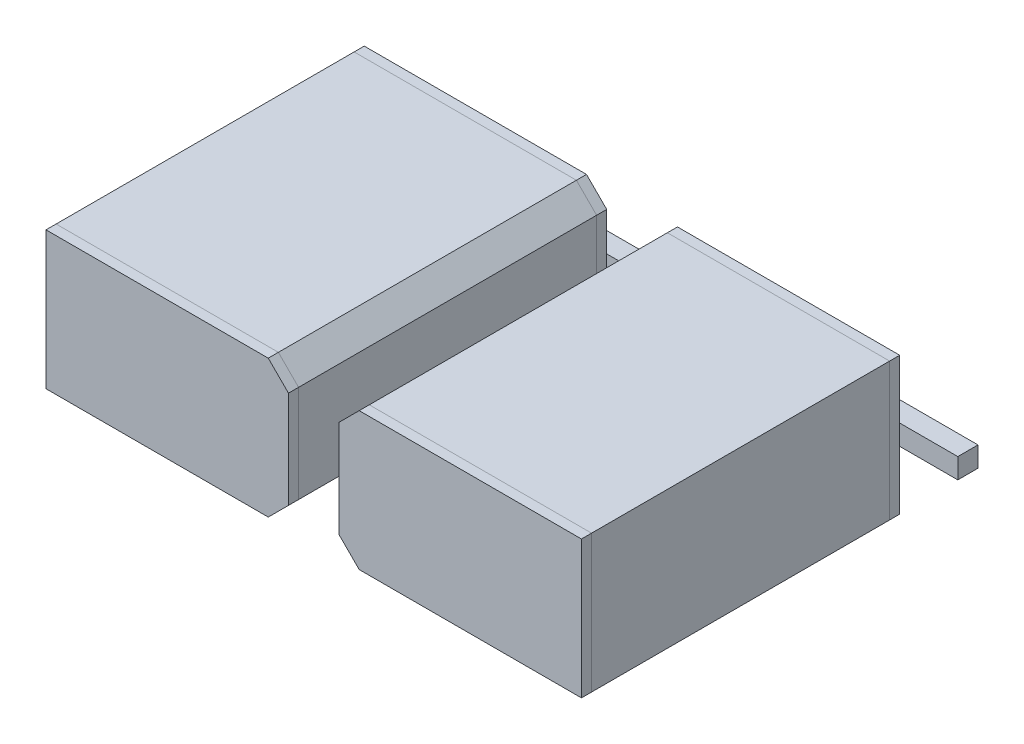
from build123d import *

# Parameters (mm, degrees)
CROQUIS1_W                = 152.375
CROQUIS1_H                = 86.5
SALIENTE_EXTRUIR1_DEPTH   = 6.35
SALIENTE_EXTRUIR1_2_DEPTH = 6.35
CHAFL_N1_SIZE             = 12.7
CHAFL_N2_SIZE             = 12.7
SALIENTE_EXTRUIR2_DEPTH   = 187.3
SALIENTE_EXTRUIR2_2_DEPTH = 187.3
SALIENTE_EXTRUIR3_DEPTH   = 6.35
SALIENTE_EXTRUIR3_2_DEPTH = 6.35
CROQUIS4_W                = 409.5
CROQUIS4_H                = 12.7
SALIENTE_EXTRUIR4_DEPTH   = 12.7


with BuildPart() as part:
    # Croquis1 → Saliente-Extruir1 (new body)
    with BuildSketch(Plane.XY):
        with Locations((107.9375, 75)):
            Rectangle(CROQUIS1_W, CROQUIS1_H)
    extrude(amount=SALIENTE_EXTRUIR1_DEPTH)

    # Chaflán1
    chafl_n1_edges = [part.edges().sort_by_distance(p)[0] for p in [
        (184.125, 118.25, 3.175),
        (184.125, 31.75, 3.175),
    ]]
    chamfer(chafl_n1_edges, length=CHAFL_N1_SIZE)


with BuildPart() as body_2:
    # Croquis1 → Saliente-Extruir1 2 (new body)
    with BuildSketch(Plane.XY):
        with Locations((292.0625, 75)):
            Rectangle(CROQUIS1_W, CROQUIS1_H)
    extrude(amount=SALIENTE_EXTRUIR1_2_DEPTH)

    # Chaflán2
    chafl_n2_edges = [body_2.edges().sort_by_distance(p)[0] for p in [
        (215.875, 118.25, 3.175),
        (215.875, 31.75, 3.175),
    ]]
    chamfer(chafl_n2_edges, length=CHAFL_N2_SIZE)


with BuildPart() as body_3:
    # Croquis2 → Saliente-Extruir2 (new body)
    with BuildSketch(Plane.XY.offset(6.35)):
        Polygon((215.875, 105.55), (215.875, 44.45), (228.575, 31.75), (368.25, 31.75), (368.25, 118.25), (228.575, 118.25), align=None)
        Polygon((222.225, 102.919743879), (222.225, 47.080256121), (231.205256121, 38.1), (361.9, 38.1), (361.9, 111.9), (231.205256121, 111.9), align=None, mode=Mode.SUBTRACT)
    extrude(amount=SALIENTE_EXTRUIR2_DEPTH)


with BuildPart() as body_4:
    # Croquis2 → Saliente-Extruir2 2 (new body)
    with BuildSketch(Plane.XY.offset(6.35)):
        Polygon((31.75, 31.75), (171.425, 31.75), (184.125, 44.45), (184.125, 105.55), (171.425, 118.25), (31.75, 118.25), align=None)
        Polygon((168.794743879, 111.9), (38.1, 111.9), (38.1, 38.1), (168.794743879, 38.1), (177.775, 47.080256121), (177.775, 102.919743879), align=None, mode=Mode.SUBTRACT)
    extrude(amount=SALIENTE_EXTRUIR2_2_DEPTH)


with BuildPart() as body_5:
    # Croquis3 → Saliente-Extruir3 (new body)
    with BuildSketch(Plane.XY.offset(193.65)):
        Polygon((368.25, 31.75), (228.575, 31.75), (215.875, 44.45), (215.875, 105.55), (228.575, 118.25), (368.25, 118.25), align=None)
    extrude(amount=SALIENTE_EXTRUIR3_DEPTH)


with BuildPart() as body_6:
    # Croquis3 → Saliente-Extruir3 2 (new body)
    with BuildSketch(Plane.XY.offset(193.65)):
        Polygon((184.125, 105.55), (184.125, 44.45), (171.425, 31.75), (31.75, 31.75), (31.75, 118.25), (171.425, 118.25), align=None)
    extrude(amount=SALIENTE_EXTRUIR3_2_DEPTH)


with BuildPart() as body_7:
    # Croquis4 → Saliente-Extruir4 (new body)
    with BuildSketch(Plane(origin=(0, 0, 0), x_dir=(-1, 0, 0), z_dir=(0, 0, -1))):
        with Locations((-200, 75)):
            Rectangle(CROQUIS4_W, CROQUIS4_H)
    extrude(amount=SALIENTE_EXTRUIR4_DEPTH)


solid = Compound([part.part, body_2.part, body_3.part, body_4.part, body_5.part, body_6.part, body_7.part])
